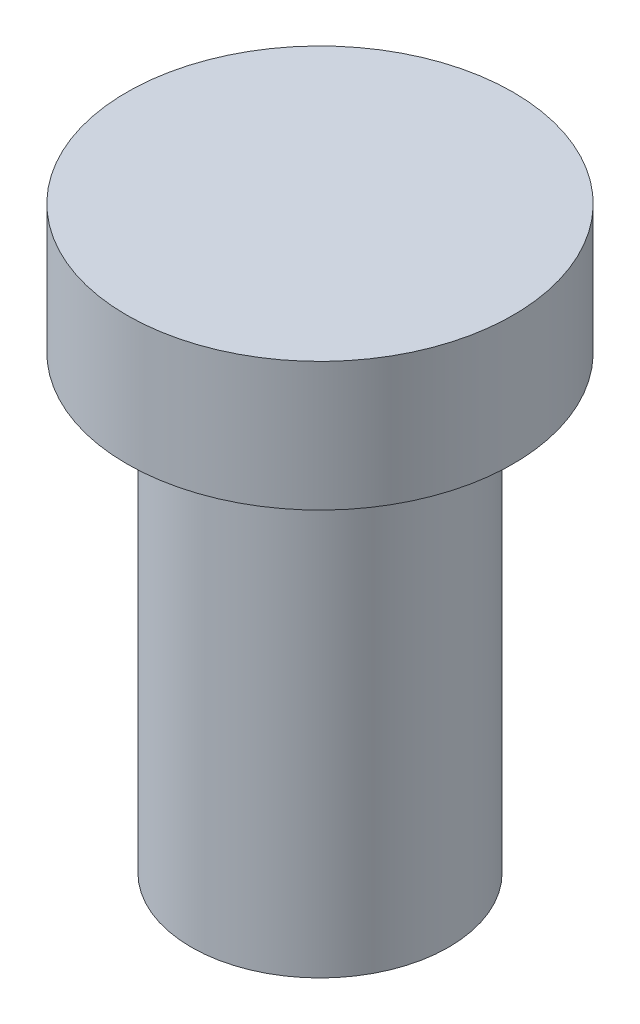
from build123d import *


with BuildPart() as part:
    # 스케치1 → 회전1 (revolve)
    with BuildSketch(Plane(origin=(0, 0, 0), x_dir=(0, 0, -1), z_dir=(1, 0, 0)), mode=Mode.PRIVATE) as revolve_1_sk:
        Polygon((0, 16.246180973), (3, 16.246180973), (3, 14.246180973), (2, 14.246180973), (2, 7.246180973), (0, 7.246180973), align=None)
    revolve(revolve_1_sk.sketch.rotate(Axis((0, 20.990482646, 0), (0, -1, 0)), 180), axis=Axis((0, 20.990482646, 0), (0, -1, 0)))


solid = part.part
